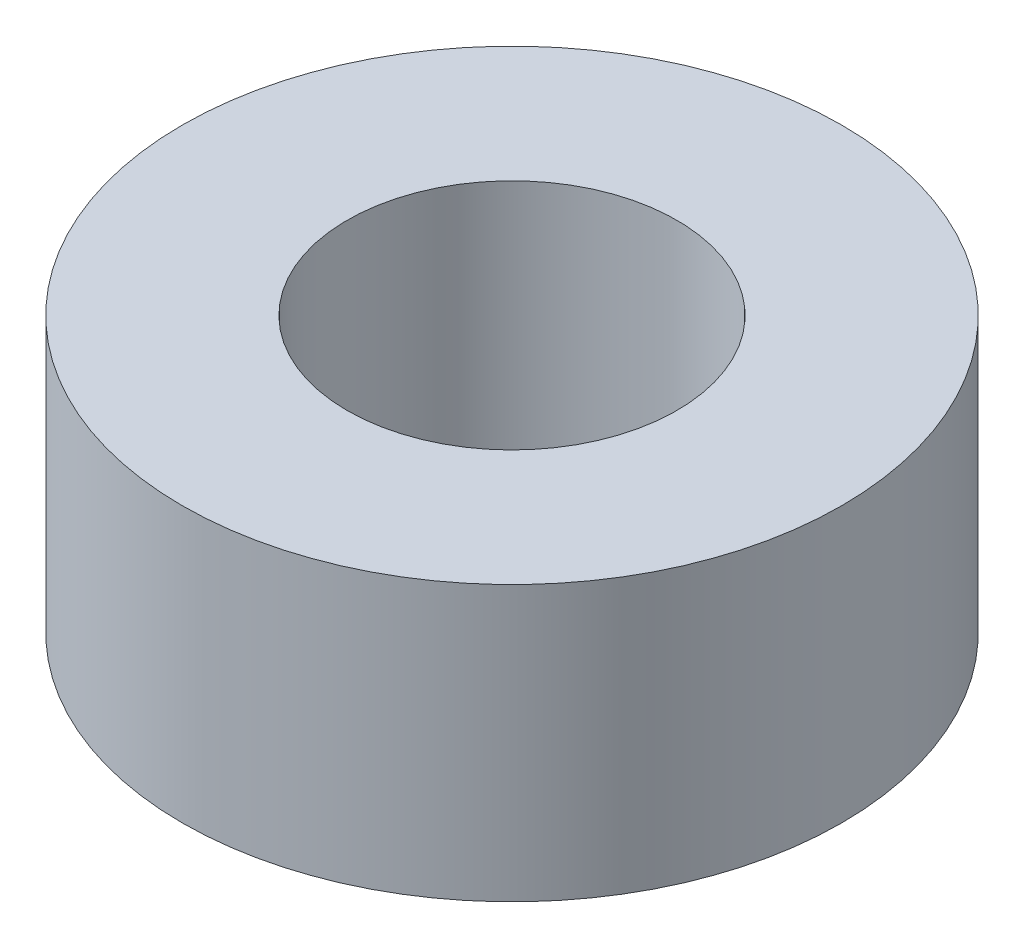
from build123d import *

# Parameters (mm, degrees)
ESQUISSE1_R        = 3
ESQUISSE1_R_2      = 1.5
BOSS_EXTRU_1_DEPTH = 2.5


with BuildPart() as part:
    # Esquisse1 → Boss.-Extru.1 (new body)
    with BuildSketch(Plane(origin=(0, 0, 0), x_dir=(1, 0, 0), z_dir=(0, 1, 0))):
        with Locations(Location((0, 0, 0), (0, 0, 270))):
            Circle(ESQUISSE1_R)
        with Locations(Location((0, 0, 0), (0, 0, 270))):
            Circle(ESQUISSE1_R_2, mode=Mode.SUBTRACT)
    extrude(amount=BOSS_EXTRU_1_DEPTH)


solid = part.part
